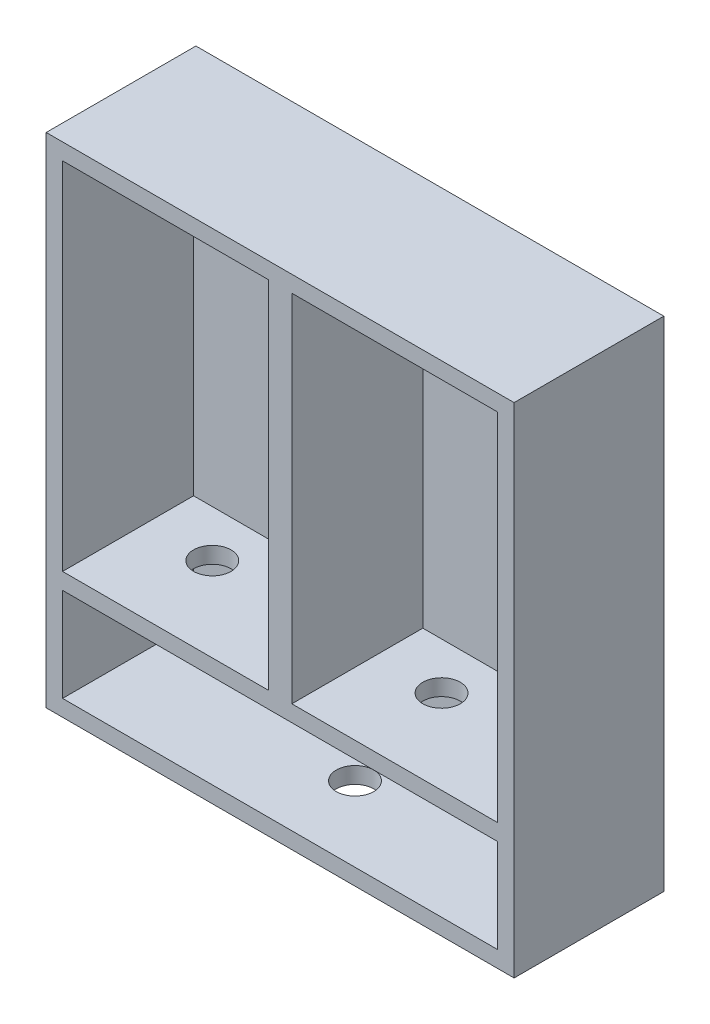
from build123d import *

# Parameters (mm, degrees)
SKETCH3_W           = 63.5
SKETCH3_H           = 67.6275
BOSS_EXTRUDE3_DEPTH = 20.32
SKETCH1_W           = 27.94
SKETCH1_H           = 48.26
SKETCH1_W_2         = 59.055
SKETCH1_H_2         = 12.7
CUT_EXTRUDE1_DEPTH  = 17.78
SKETCH4_R           = 2.54
CUT_EXTRUDE2_DEPTH  = 2.2225
SKETCH5_R           = 2.54
CUT_EXTRUDE3_DEPTH  = 2.2225


with BuildPart() as part:
    # Sketch3 → Boss-Extrude3 (new body)
    with BuildSketch(Plane.XY):
        with Locations((-31.75, 33.81375)):
            Rectangle(SKETCH3_W, SKETCH3_H)
    extrude(amount=BOSS_EXTRUDE3_DEPTH)

    # Sketch1 → Cut-Extrude1 (cut)
    with BuildSketch(Plane.XY.offset(20.32)):
        with Locations((-47.3075, 41.275)):
            Rectangle(SKETCH1_W, SKETCH1_H)
        with Locations((-16.1925, 41.275)):
            Rectangle(SKETCH1_W, SKETCH1_H)
        with Locations((-31.75, 8.5725)):
            Rectangle(SKETCH1_W_2, SKETCH1_H_2)
    extrude(amount=-CUT_EXTRUDE1_DEPTH, mode=Mode.SUBTRACT)

    # Sketch4 → Cut-Extrude2 (cut)
    with BuildSketch(Plane.XZ):
        with Locations(Location((-31.75, 10.16, 0), (0, 0, 270))):
            Circle(SKETCH4_R)
    extrude(amount=-CUT_EXTRUDE2_DEPTH, mode=Mode.SUBTRACT)

    # Sketch5 → Cut-Extrude3 (cut)
    with BuildSketch(Plane(origin=(0, 14.9225, 0), x_dir=(-1, 0, 0), z_dir=(0, -1, 0))):
        with Locations(Location((52.3875, -8.89, 0), (0, 0, 90))):
            Circle(SKETCH5_R)
        with Locations(Location((21.2725, -8.89, 0), (0, 0, 90))):
            Circle(SKETCH5_R)
    extrude(amount=-CUT_EXTRUDE3_DEPTH, mode=Mode.SUBTRACT)


solid = part.part
